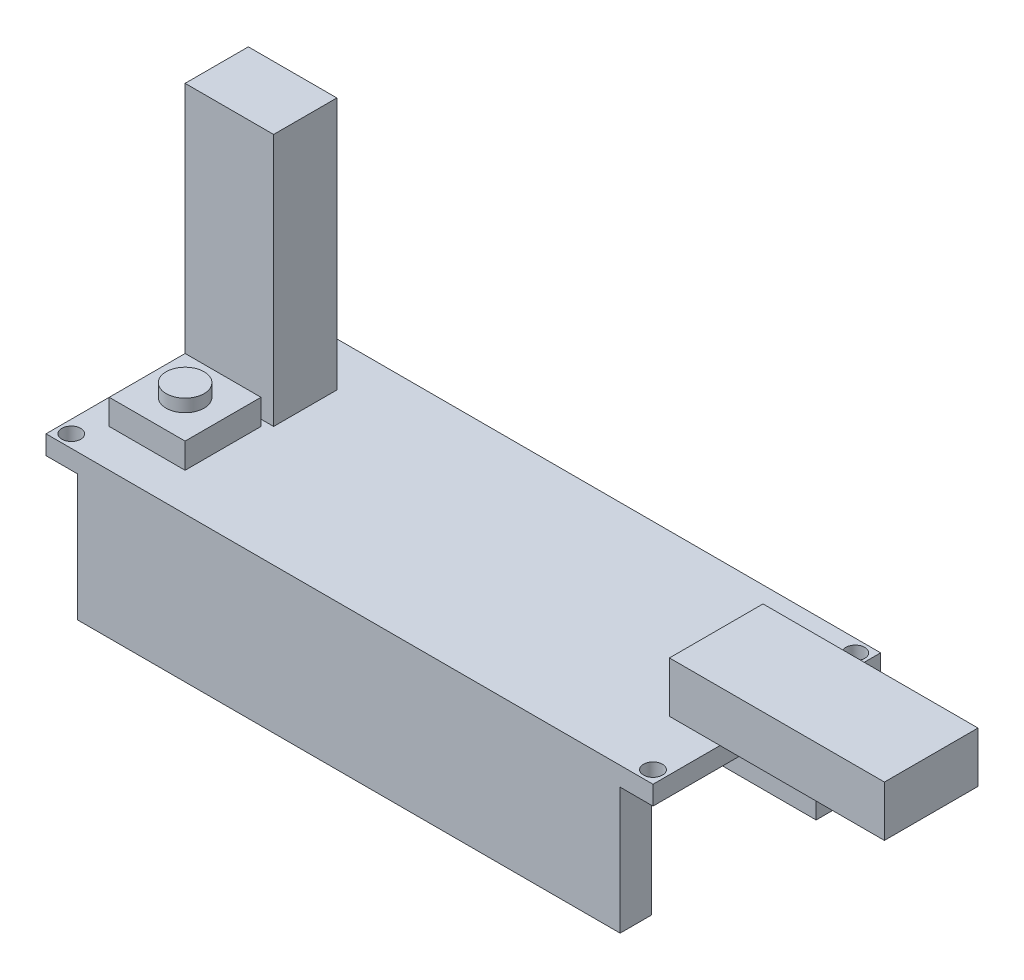
from build123d import *

# Parameters (mm, degrees)
SKETCH_1_W          = 48
SKETCH_1_H          = 18
EXTRUDE_1_DEPTH     = 1.5
EXTRUDE_2_DEPTH     = 4
SKETCH_4_W          = 42.9
SKETCH_4_H          = 2.5
EXTRUDE_3_DEPTH     = 10
SKETCH_5_W          = 7
SKETCH_5_H          = 5
EXTRUDE_4_DEPTH     = 20
SKETCH_6_W          = 6
SKETCH_6_H          = 6
EXTRUDE_5_DEPTH     = 2
EXTRUDE_6_DEPTH     = 1
SKETCH_8_R          = 0.75
CUT_EXTRUDE_1_DEPTH = 10


with BuildPart() as part:
    # Эскиз1 → Бобышка-Вытянуть1 (new body)
    with BuildSketch(Plane(origin=(0, 0, 0), x_dir=(1, 0, 0), z_dir=(0, 1, 0))):
        with Locations((-24, 9)):
            Rectangle(SKETCH_1_W, SKETCH_1_H)
    extrude(amount=EXTRUDE_1_DEPTH)

    # Эскиз2 → Бобышка-Вытянуть2 (add)
    with BuildSketch(Plane(origin=(0, 1.5, 0), x_dir=(1, 0, 0), z_dir=(0, 1, 0))):
        Polygon((0, 12.7), (0, 9), (0, 5.3), (13, 5.3), (13, 12.7), align=None)
        Polygon((0, 5.3), (0, 9), (0, 12.7), (-4, 12.7), (-4, 5.3), align=None)
    extrude(amount=EXTRUDE_2_DEPTH)

    # Эскиз4 → Бобышка-Вытянуть3 (add)
    with BuildSketch(Plane(origin=(0, 0, 0), x_dir=(-1, 0, 0), z_dir=(0, -1, 0))):
        with Locations((24.05, 16.75)):
            Rectangle(SKETCH_4_W, SKETCH_4_H)
        with Locations((24.05, 1.25)):
            Rectangle(SKETCH_4_W, SKETCH_4_H)
    extrude(amount=EXTRUDE_3_DEPTH)

    # Эскиз5 → Бобышка-Вытянуть4 (add)
    with BuildSketch(Plane(origin=(0, 1.5, 0), x_dir=(1, 0, 0), z_dir=(0, 1, 0))):
        with Locations((-43, 12)):
            Rectangle(SKETCH_5_W, SKETCH_5_H)
    extrude(amount=EXTRUDE_4_DEPTH)

    # Эскиз6 → Бобышка-Вытянуть5 (add)
    with BuildSketch(Plane(origin=(0, 1.5, 0), x_dir=(1, 0, 0), z_dir=(0, 1, 0))):
        with Locations((-43, 6)):
            Rectangle(SKETCH_6_W, SKETCH_6_H)
    extrude(amount=EXTRUDE_5_DEPTH)

    # Эскиз7 → Бобышка-Вытянуть6 (add)
    with BuildSketch(Plane(origin=(0, 3.5, 0), x_dir=(1, 0, 0), z_dir=(0, 1, 0))):
        with BuildLine():
            ThreePointArc((-41.939339828, 7.060660172), (-43, 7.5), (-44.060660172, 7.060660172))
            Line((-44.060660172, 7.060660172), (-43, 6))
            Line((-43, 6), (-41.939339828, 7.060660172))
        make_face()
        with BuildLine():
            Line((-43, 6), (-44.060660172, 7.060660172))
            ThreePointArc((-44.060660172, 7.060660172), (-44.5, 6), (-44.060660172, 4.939339828))
            Line((-44.060660172, 4.939339828), (-43, 6))
        make_face()
        with BuildLine():
            Line((-41.939339828, 7.060660172), (-43, 6))
            Line((-43, 6), (-41.939339828, 4.939339828))
            ThreePointArc((-41.939339828, 4.939339828), (-41.614180701, 5.425974851), (-41.5, 6))
            ThreePointArc((-41.5, 6), (-41.614180701, 6.574025149), (-41.939339828, 7.060660172))
        make_face()
        with BuildLine():
            Line((-41.939339828, 4.939339828), (-43, 6))
            Line((-43, 6), (-44.060660172, 4.939339828))
            ThreePointArc((-44.060660172, 4.939339828), (-43, 4.5), (-41.939339828, 4.939339828))
        make_face()
    extrude(amount=EXTRUDE_6_DEPTH)

    # Эскиз8 → Вырез-Вытянуть1 (cut)
    with BuildSketch(Plane(origin=(0, 1.5, 0), x_dir=(1, 0, 0), z_dir=(0, 1, 0))):
        with Locations(Location((-47, 17, 0), (0, 0, 270))):
            Circle(SKETCH_8_R)
        with Locations(Location((-47, 1, 0), (0, 0, 90))):
            Circle(SKETCH_8_R)
        with Locations(Location((-1, 1, 0), (0, 0, 270))):
            Circle(SKETCH_8_R)
        with Locations(Location((-1, 17, 0), (0, 0, 90))):
            Circle(SKETCH_8_R)
    extrude(amount=-CUT_EXTRUDE_1_DEPTH, mode=Mode.SUBTRACT)


solid = part.part
